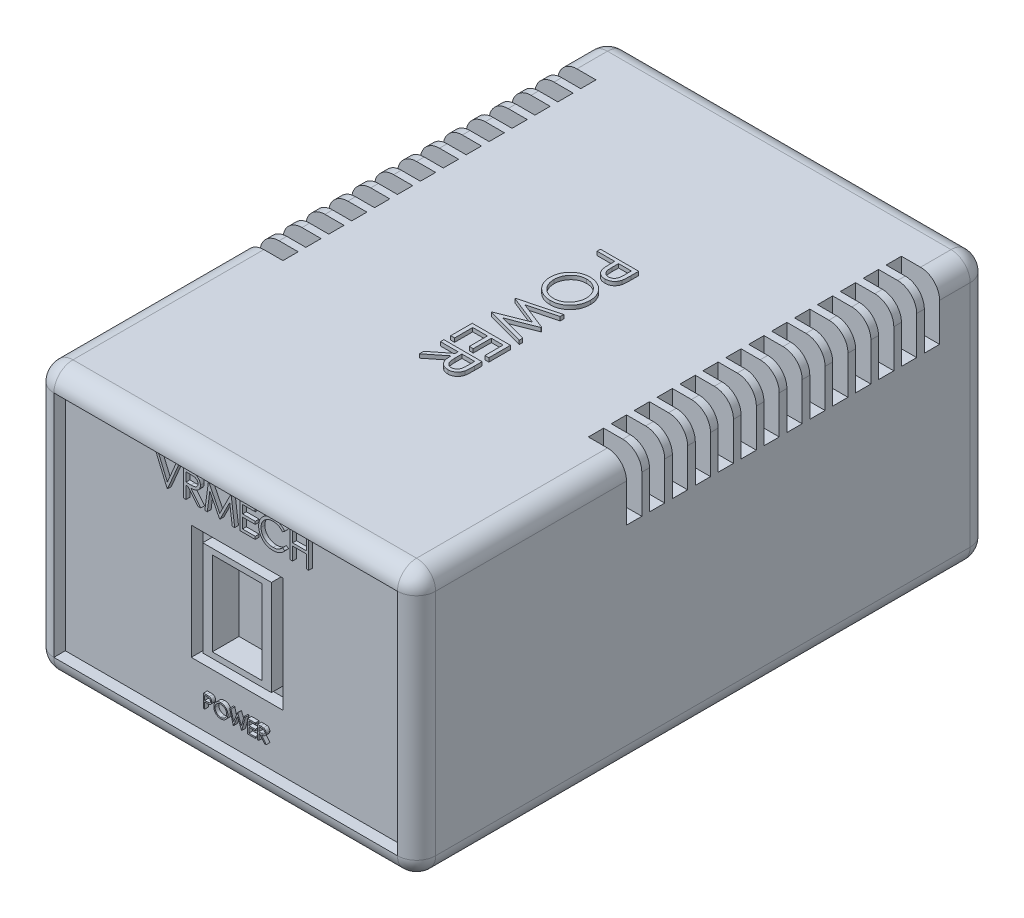
from build123d import *

# Parameters (mm, degrees)
IZIM1_W                     = 100
IZIM1_H                     = 70
Y_KSEKLIK_EKSTR_ZYON1_DEPTH = 150
RADYUS1_R                   = 5
IZIM2_W                     = 90
IZIM2_H                     = 60
KES_EKSTR_ZYON1_DEPTH       = 3
IZIM4_W                     = 10
IZIM4_H                     = 4
KES_EKSTR_ZYON2_DEPTH       = 15
IZIM5_W                     = 10
IZIM5_H                     = 4
KES_EKSTR_ZYON3_DEPTH       = 15
IZIM6_W                     = 24
IZIM6_H                     = 30
IZIM6_W_2                   = 18
IZIM6_H_2                   = 25
KES_EKSTR_ZYON4_DEPTH       = 3
IZIM7_W                     = 13
IZIM7_H                     = 22
KES_EKSTR_ZYON5_DEPTH       = 7
IZIM8_R                     = 0.5
KES_EKSTR_ZYON6_DEPTH       = 1
Y_KSEKLIK_EKSTR_ZYON2_DEPTH = 1
Y_KSEKLIK_EKSTR_ZYON3_DEPTH = 1
Y_KSEKLIK_EKSTR_ZYON4_DEPTH = 1


with BuildPart() as part:
    # Çizim1 → Yükseklik-Ekstrüzyon1 (new body)
    with BuildSketch(Plane.XY):
        Rectangle(IZIM1_W, IZIM1_H)
    extrude(amount=Y_KSEKLIK_EKSTR_ZYON1_DEPTH)

    # Radyus1
    radyus1_edges = [part.edges().sort_by_distance(p)[0] for p in [
        (-50, 0, 150),
        (0, -35, 150),
        (50, 0, 150),
        (0, -35, 0),
        (-50, 0, 0),
        (0, 35, 0),
        (50, 0, 0),
        (50, -35, 75),
        (-50, -35, 75),
        (-50, 35, 75),
        (50, 35, 75),
        (0, 35, 150),
    ]]
    fillet(radyus1_edges, radius=RADYUS1_R)

    # Çizim2 → Kes-Ekstrüzyon1 (cut)
    with BuildSketch(Plane.XY.offset(150)):
        Rectangle(IZIM2_W, IZIM2_H)
    extrude(amount=-KES_EKSTR_ZYON1_DEPTH, mode=Mode.SUBTRACT)

    # Çizim4 → Kes-Ekstrüzyon2 (cut)
    with BuildSketch(Plane(origin=(0, 35, 0), x_dir=(1, 0, 0), z_dir=(0, 1, 0))):
        with Locations((-45, -15)):
            Rectangle(IZIM4_W, IZIM4_H)
        with Locations((-45, -21)):
            Rectangle(IZIM4_W, IZIM4_H)
        with Locations((-45, -27)):
            Rectangle(IZIM4_W, IZIM4_H)
        with Locations((-45, -33)):
            Rectangle(IZIM4_W, IZIM4_H)
        with Locations((-45, -39)):
            Rectangle(IZIM4_W, IZIM4_H)
        with Locations((-45, -45)):
            Rectangle(IZIM4_W, IZIM4_H)
        with Locations((-45, -51)):
            Rectangle(IZIM4_W, IZIM4_H)
        with Locations((-45, -57)):
            Rectangle(IZIM4_W, IZIM4_H)
        with Locations((-45, -63)):
            Rectangle(IZIM4_W, IZIM4_H)
        with Locations((-45, -69)):
            Rectangle(IZIM4_W, IZIM4_H)
        with Locations((-45, -75)):
            Rectangle(IZIM4_W, IZIM4_H)
        with Locations((-45, -81)):
            Rectangle(IZIM4_W, IZIM4_H)
        with Locations((-45, -87)):
            Rectangle(IZIM4_W, IZIM4_H)
        with Locations((-45, -93)):
            Rectangle(IZIM4_W, IZIM4_H)
        with Locations((45, -93)):
            Rectangle(IZIM4_W, IZIM4_H)
        with Locations((45, -87)):
            Rectangle(IZIM4_W, IZIM4_H)
        with Locations((45, -81)):
            Rectangle(IZIM4_W, IZIM4_H)
        with Locations((45, -75)):
            Rectangle(IZIM4_W, IZIM4_H)
        with Locations((45, -69)):
            Rectangle(IZIM4_W, IZIM4_H)
        with Locations((45, -63)):
            Rectangle(IZIM4_W, IZIM4_H)
        with Locations((45, -57)):
            Rectangle(IZIM4_W, IZIM4_H)
        with Locations((45, -51)):
            Rectangle(IZIM4_W, IZIM4_H)
        with Locations((45, -39)):
            Rectangle(IZIM4_W, IZIM4_H)
        with Locations((45, -33)):
            Rectangle(IZIM4_W, IZIM4_H)
        with Locations((45, -27)):
            Rectangle(IZIM4_W, IZIM4_H)
        with Locations((45, -21)):
            Rectangle(IZIM4_W, IZIM4_H)
        with Locations((45, -15)):
            Rectangle(IZIM4_W, IZIM4_H)
    extrude(amount=-KES_EKSTR_ZYON2_DEPTH, mode=Mode.SUBTRACT)

    # Çizim5 → Kes-Ekstrüzyon3 (cut)
    with BuildSketch(Plane(origin=(0, 35, 0), x_dir=(1, 0, 0), z_dir=(0, 1, 0))):
        with Locations((45, -45)):
            Rectangle(IZIM5_W, IZIM5_H)
    extrude(amount=-KES_EKSTR_ZYON3_DEPTH, mode=Mode.SUBTRACT)

    # Çizim6 → Kes-Ekstrüzyon4 (cut)
    with BuildSketch(Plane.XY.offset(147)):
        Rectangle(IZIM6_W, IZIM6_H)
        Rectangle(IZIM6_W_2, IZIM6_H_2, mode=Mode.SUBTRACT)
    extrude(amount=-KES_EKSTR_ZYON4_DEPTH, mode=Mode.SUBTRACT)

    # Çizim7 → Kes-Ekstrüzyon5 (cut)
    with BuildSketch(Plane.XY.offset(147)):
        Rectangle(IZIM7_W, IZIM7_H)
    extrude(amount=-KES_EKSTR_ZYON5_DEPTH, mode=Mode.SUBTRACT)

    # Çizim8 → Kes-Ekstrüzyon6 (cut)
    with BuildSketch(Plane.ZY.offset(-6.5)):
        with Locations((145, 0)):
            Circle(IZIM8_R)
    extrude(amount=-KES_EKSTR_ZYON6_DEPTH, mode=Mode.SUBTRACT)

    # Çizim10 → Yükseklik-Ekstrüzyon2 (add)
    # profile 1 of 6: a face of its own
    with BuildSketch(Plane.XY.offset(147)):
        Polygon((14.897435897, 28.115628908), (15.525641026, 28.115628908), (15.525641026, 25.243834036), (19.115384615, 25.243834036), (19.115384615, 28.115628908), (19.743589744, 28.115628908), (19.743589744, 21.115628908), (19.115384615, 21.115628908), (19.115384615, 24.525885318), (15.525641026, 24.525885318), (15.525641026, 21.115628908), (14.897435897, 21.115628908), align=None)
    # profile 2 of 6: a face of its own
    with BuildSketch(Plane.XY.offset(147)):
        with BuildLine():
            Line((13.461538462, 26.83117378), (12.911858974, 26.410500703))
            add(Edge.make_bspline(
                [(12.911858974, 26.410500703), (12.872647198, 26.457232643), (12.794752304, 26.550066474), (12.669433899, 26.680425563), (12.538830613, 26.802556086), (12.402992371, 26.917039845), (12.259474132, 27.019873377), (12.111752534, 27.116415582), (11.957356444, 27.202951058), (11.743852975, 27.307877031), (11.464557278, 27.417369341), (11.1129676, 27.509175803), (10.745945403, 27.567618155), (10.495550204, 27.573947837), (10.368189103, 27.57716737)],
                knots=[0, 0, 0, 0, 0.757959112, 1.505699292, 2.245454638, 2.979532153, 3.711538275, 4.438200793, 5.171680507, 5.909471876, 7.393775596, 8.890124382, 10.418191784, 12, 12, 12, 12], degree=3))
            add(Edge.make_bspline(
                [(10.368189103, 27.57716737), (10.298022504, 27.576359445), (10.158340519, 27.574751093), (9.951043572, 27.553532842), (9.747617469, 27.523710422), (9.548194537, 27.479459776), (9.35302862, 27.423514538), (9.160843816, 27.35666371), (8.974422616, 27.27395403), (8.79118614, 27.18253751), (8.615627718, 27.079282621), (8.449517622, 26.966655917), (8.293461686, 26.845917724), (8.147336462, 26.716615511), (8.010992565, 26.57933159), (7.885417944, 26.432602907), (7.771047123, 26.27689856), (7.665613073, 26.114271745), (7.571187607, 25.945196162), (7.492127848, 25.769046021), (7.422117603, 25.588837815), (7.366719118, 25.402535493), (7.322870084, 25.211449962), (7.292614758, 25.015068386), (7.271637815, 24.813801026), (7.270037462, 24.677382401), (7.269230769, 24.60861769)],
                knots=[0, 0, 0, 0, 1.054917814, 2.100044995, 3.131103042, 4.146048494, 5.169673617, 6.183595914, 7.203665975, 8.234915748, 9.262203917, 10.264457458, 11.251630812, 12.227803204, 13.197192746, 14.159520551, 15.12972552, 16.100847026, 17.073214652, 18.039054194, 19.002613845, 19.979014051, 20.95965708, 21.949030935, 22.966165397, 24, 24, 24, 24], degree=3))
            add(Edge.make_bspline(
                [(7.269230769, 24.60861769), (7.271754407, 24.50515505), (7.276709236, 24.302019881), (7.320805904, 24.004478659), (7.387816087, 23.719437312), (7.48824724, 23.448677627), (7.612085342, 23.188860911), (7.768566565, 22.944383204), (7.949799639, 22.711550075), (8.158348478, 22.49586418), (8.38716011, 22.298836729), (8.632655933, 22.125335566), (8.894224509, 21.980705801), (9.168977769, 21.860353908), (9.459029997, 21.767840453), (9.763859602, 21.702712206), (10.082803593, 21.660227845), (10.300742392, 21.656160469), (10.411658654, 21.654090447)],
                knots=[0, 0, 0, 0, 1.029171465, 2.020641659, 2.987623507, 3.938342917, 4.889210282, 5.84687017, 6.821220943, 7.821438502, 8.827599549, 9.822697543, 10.807740252, 11.797342354, 12.80366471, 13.83203677, 14.896651826, 16, 16, 16, 16], degree=3))
            add(Edge.make_bspline(
                [(10.411658654, 21.654090447), (10.533864032, 21.657468006), (10.77439345, 21.664115851), (11.127129502, 21.720434349), (11.464801034, 21.811750185), (11.787426207, 21.93954603), (12.094095499, 22.105676605), (12.38528882, 22.30707236), (12.661251961, 22.545649026), (12.827194525, 22.727815282), (12.911858974, 22.820757113)],
                knots=[0, 0, 0, 0, 1.028121516, 2.023589091, 2.998037872, 3.967518031, 4.937445131, 5.927275754, 6.942489185, 8, 8, 8, 8], degree=3))
            Line((12.911858974, 22.820757113), (13.461538462, 22.404290767))
            add(Edge.make_bspline(
                [(13.461538462, 22.404290767), (13.417302242, 22.347213863), (13.329041691, 22.233333451), (13.186125657, 22.072790031), (13.035571062, 21.92178196), (12.876259642, 21.781526718), (12.710024059, 21.649217787), (12.533879435, 21.528614124), (12.35014137, 21.418032355), (12.159432412, 21.316778506), (11.961955186, 21.226944012), (11.757946316, 21.150036477), (11.548285165, 21.083786698), (11.332962148, 21.029282824), (11.111530635, 20.986740656), (10.884789687, 20.958301307), (10.652249936, 20.938817478), (10.495367094, 20.937041646), (10.415865385, 20.936141729)],
                knots=[0, 0, 0, 0, 0.986787822, 1.968848986, 2.935600012, 3.899624008, 4.868462664, 5.837806735, 6.815139263, 7.798259679, 8.787526145, 9.778297419, 10.776456485, 11.791383307, 12.812564526, 13.85620153, 14.913611965, 16, 16, 16, 16], degree=3))
            add(Edge.make_bspline(
                [(10.415865385, 20.936141729), (10.34057805, 20.936665714), (10.19170667, 20.937701829), (9.971909167, 20.954486164), (9.757930005, 20.977385638), (9.550380754, 21.0118659), (9.348128804, 21.05255458), (9.153007635, 21.107097093), (8.963097214, 21.168195427), (8.779160533, 21.2400054), (8.601041133, 21.321037765), (8.42931351, 21.412620883), (8.264056645, 21.513984612), (8.103645804, 21.622894633), (7.950450636, 21.742849237), (7.803143586, 21.872182506), (7.660898633, 22.010458527), (7.572893263, 22.110168234), (7.528645833, 22.160300382)],
                knots=[0, 0, 0, 0, 1.114604814, 2.203992996, 3.262667896, 4.300477797, 5.318619304, 6.316056647, 7.298880507, 8.271930387, 9.238335007, 10.195173496, 11.151986948, 12.108099108, 13.064862484, 14.031167946, 15.010108607, 16, 16, 16, 16], degree=3))
            add(Edge.make_bspline(
                [(7.528645833, 22.160300382), (7.457774546, 22.24738276), (7.316887593, 22.420496181), (7.136636226, 22.701068144), (6.982341115, 22.994004561), (6.857589274, 23.300844419), (6.760063807, 23.620899193), (6.692501417, 23.954330222), (6.648598208, 24.300826107), (6.643577631, 24.536499684), (6.641025641, 24.656293972)],
                knots=[0, 0, 0, 0, 0.994628077, 1.977248131, 2.950237994, 3.925870899, 4.908910175, 5.911660606, 6.938484602, 8, 8, 8, 8], degree=3))
            add(Edge.make_bspline(
                [(6.641025641, 24.656293972), (6.644136028, 24.782204879), (6.650255521, 25.029926728), (6.702247112, 25.393474635), (6.785884704, 25.741777433), (6.904678481, 26.074184922), (7.055289184, 26.392445482), (7.241342411, 26.694127892), (7.460676696, 26.981161491), (7.711571831, 27.249190994), (7.986706502, 27.494269699), (8.28134413, 27.709882107), (8.594908024, 27.889317139), (8.923943727, 28.039309463), (9.27091509, 28.15459839), (9.635081828, 28.235304763), (10.015759658, 28.285538996), (10.275484509, 28.291889412), (10.407451923, 28.295116088)],
                knots=[0, 0, 0, 0, 1.032925535, 2.032216505, 3.007276963, 3.968222605, 4.92396291, 5.891752235, 6.871517503, 7.883894988, 8.900124299, 9.891468569, 10.874487609, 11.85992873, 12.854644235, 13.869047385, 14.917252991, 16, 16, 16, 16], degree=3))
            add(Edge.make_bspline(
                [(10.407451923, 28.295116088), (10.487880867, 28.294151811), (10.647081862, 28.292243123), (10.882587166, 28.273630839), (11.11187182, 28.242603626), (11.335093784, 28.200371487), (11.553339017, 28.147956844), (11.764939499, 28.079676247), (11.971136872, 28.001603185), (12.170630689, 27.911686253), (12.362463789, 27.81075277), (12.546576426, 27.699921523), (12.721506143, 27.579329912), (12.88848384, 27.450003561), (13.044716262, 27.309206442), (13.194639219, 27.160811251), (13.333161376, 27.000543602), (13.418667766, 26.887733734), (13.461538462, 26.83117378)],
                knots=[0, 0, 0, 0, 1.096760587, 2.17092713, 3.219439832, 4.250915756, 5.268269357, 6.278326846, 7.281116186, 8.274029601, 9.260640565, 10.235837813, 11.203064059, 12.156899882, 13.114053108, 14.069676657, 15.032185724, 16, 16, 16, 16], degree=3))
        make_face()
    # profile 3 of 6: a face of its own
    with BuildSketch(Plane.XY.offset(147)):
        Polygon((1.794871795, 28.115628908), (5.743589744, 28.115628908), (5.743589744, 27.39768019), (2.423076923, 27.39768019), (2.423076923, 25.243834036), (5.743589744, 25.243834036), (5.743589744, 24.525885318), (2.423076923, 24.525885318), (2.423076923, 21.833577626), (5.743589744, 21.833577626), (5.743589744, 21.115628908), (1.794871795, 21.115628908), align=None)
    # profile 4 of 6: a face of its own
    with BuildSketch(Plane.XY.offset(147)):
        Polygon((-7.448717949, 21.115628908), (-6.524639423, 28.115628908), (-6.434895833, 28.115628908), (-3.544871795, 22.372039164), (-0.661858974, 28.115628908), (-0.570713141, 28.115628908), (0.358974359, 21.115628908), (-0.272035256, 21.115628908), (-0.942307692, 26.152487882), (-3.469150641, 21.115628908), (-3.610777244, 21.115628908), (-6.147435897, 26.163705831), (-6.81630609, 21.115628908), align=None)
    # profile 5 of 6: a face of its own
    with BuildSketch(Plane.XY.offset(147)):
        with BuildLine():
            Line((-13.012820513, 28.115628908), (-11.611979167, 28.115628908))
            add(Edge.make_bspline(
                [(-11.611979167, 28.115628908), (-11.51849691, 28.115317736), (-11.339000621, 28.114720251), (-11.08185408, 28.111388726), (-10.848199886, 28.101840014), (-10.638160207, 28.093622847), (-10.451738898, 28.078638965), (-10.288364316, 28.06431767), (-10.148788921, 28.045570349), (-10.064297218, 28.028159503), (-10.026041667, 28.020276344)],
                knots=[0, 0, 0, 0, 1.410062039, 2.707475311, 3.878576406, 4.937260626, 5.877586885, 6.699081471, 7.410979367, 8, 8, 8, 8], degree=3))
            add(Edge.make_bspline(
                [(-10.026041667, 28.020276344), (-9.974828418, 28.007622813), (-9.873494439, 27.982585686), (-9.727594307, 27.929666484), (-9.588565659, 27.868427235), (-9.456986011, 27.796499794), (-9.333514428, 27.713350235), (-9.216877807, 27.62041399), (-9.10654688, 27.518199579), (-9.00698362, 27.404129896), (-8.913105516, 27.284456876), (-8.833928263, 27.155049363), (-8.765675304, 27.019726308), (-8.71133427, 26.877111472), (-8.667578323, 26.728587928), (-8.636725844, 26.572810335), (-8.618223469, 26.410488385), (-8.616339758, 26.299772567), (-8.615384615, 26.243633716)],
                knots=[0, 0, 0, 0, 1.027469482, 2.033020251, 3.019912614, 3.986113645, 4.951240523, 5.91722682, 6.890402269, 7.87763091, 8.8651537, 9.85103654, 10.82876324, 11.815024772, 12.821070561, 13.842952187, 14.906261191, 16, 16, 16, 16], degree=3))
            add(Edge.make_bspline(
                [(-8.615384615, 26.243633716), (-8.618322612, 26.150363507), (-8.624055403, 25.968369171), (-8.677505611, 25.704247408), (-8.76505865, 25.457868779), (-8.885705228, 25.229543503), (-9.039344179, 25.023722212), (-9.223993762, 24.842941301), (-9.439756985, 24.691661476), (-9.640615617, 24.586755867), (-9.818044016, 24.51957005), (-9.964110641, 24.472297332), (-10.123444596, 24.435773401), (-10.294519266, 24.403053138), (-10.478046577, 24.378349749), (-10.673586655, 24.36025656), (-10.881278959, 24.348948463), (-11.023957097, 24.347264453), (-11.097355769, 24.346398139)],
                knots=[0, 0, 0, 0, 1.260483769, 2.459530307, 3.627416485, 4.787058657, 5.939039949, 7.08810263, 8.267026773, 9.491475466, 10.141966685, 10.831826277, 11.566392101, 12.351337768, 13.187381173, 14.07005841, 15.007169909, 16, 16, 16, 16], degree=3))
            Line((-11.097355769, 24.346398139), (-8.525641026, 21.115628908))
            Line((-8.525641026, 21.115628908), (-9.302483974, 21.115628908))
            Line((-9.302483974, 21.115628908), (-11.874198718, 24.346398139))
            Line((-11.874198718, 24.346398139), (-12.384615385, 24.346398139))
            Line((-12.384615385, 24.346398139), (-12.384615385, 21.115628908))
            Line((-12.384615385, 21.115628908), (-13.012820513, 21.115628908))
            Line((-13.012820513, 21.115628908), (-13.012820513, 28.115628908))
        make_face()
        with BuildLine():
            Line((-12.384615385, 27.39768019), (-12.384615385, 25.064346857))
            Line((-12.384615385, 25.064346857), (-11.102964744, 25.054531152))
            add(Edge.make_bspline(
                [(-11.102964744, 25.054531152), (-11.043124666, 25.054504678), (-10.927137552, 25.054453366), (-10.759336222, 25.062440918), (-10.603095999, 25.071527554), (-10.459014494, 25.085426246), (-10.327027344, 25.103338389), (-10.207200517, 25.125744357), (-10.099338413, 25.151848483), (-9.973541336, 25.192251734), (-9.833068274, 25.256263771), (-9.680405354, 25.349394768), (-9.550400678, 25.466533007), (-9.440564954, 25.600479919), (-9.352306091, 25.747752416), (-9.290081982, 25.906585155), (-9.250597098, 26.072968351), (-9.245940007, 26.187324567), (-9.243589744, 26.245035959)],
                knots=[0, 0, 0, 0, 1.146690395, 2.22261258, 3.21895312, 4.145990853, 4.996080663, 5.770904154, 6.481378293, 7.121626537, 8.300444488, 9.431385265, 10.535395872, 11.636531494, 12.74115979, 13.810798291, 14.895190096, 16, 16, 16, 16], degree=3))
            add(Edge.make_bspline(
                [(-9.243589744, 26.245035959), (-9.245993986, 26.301329107), (-9.250758316, 26.412881584), (-9.289655854, 26.576193405), (-9.355434616, 26.730327305), (-9.444079092, 26.874656275), (-9.552077402, 27.005667747), (-9.678713027, 27.117762053), (-9.820523418, 27.210260982), (-9.953065814, 27.269369743), (-10.071534239, 27.30560945), (-10.174393559, 27.331111777), (-10.290616515, 27.351600715), (-10.420767432, 27.368016837), (-10.564290694, 27.382126725), (-10.721911996, 27.391630283), (-10.892585556, 27.397258011), (-11.010879419, 27.397536189), (-11.072115385, 27.39768019)],
                knots=[0, 0, 0, 0, 1.101028733, 2.181837193, 3.264309656, 4.369019818, 5.486613113, 6.575447106, 7.666700264, 8.788928104, 9.402425223, 10.0903467, 10.862060571, 11.710948788, 12.657782767, 13.684531032, 14.801375019, 16, 16, 16, 16], degree=3))
            Line((-11.072115385, 27.39768019), (-12.384615385, 27.39768019))
        make_face(mode=Mode.SUBTRACT)
    # profile 6 of 6: a face of its own
    with BuildSketch(Plane.XY.offset(147)):
        Polygon((-20.282051282, 28.115628908), (-19.608974359, 28.115628908), (-17.275641026, 22.599202626), (-14.942307692, 28.115628908), (-14.269230769, 28.115628908), (-17.230769231, 21.115628908), (-17.320512821, 21.115628908), align=None)
    extrude(amount=Y_KSEKLIK_EKSTR_ZYON2_DEPTH)

    # Çizim11 → Yükseklik-Ekstrüzyon3 (add)
    # profile 1 of 5: a face of its own
    with BuildSketch(Plane(origin=(0, 35, 0), x_dir=(1, 0, 0), z_dir=(0, 1, 0))):
        with BuildLine():
            Line((10, -51.821992877), (10, -53.783130698))
            add(Edge.make_bspline(
                [(10, -53.783130698), (9.999851725, -53.918019001), (9.999567624, -54.17647098), (9.990954064, -54.547085425), (9.97944923, -54.883684659), (9.963500963, -55.18554289), (9.944653563, -55.453588884), (9.918219164, -55.68660974), (9.89061832, -55.886437044), (9.862557158, -56.006169757), (9.849759615, -56.060774929)],
                knots=[0, 0, 0, 0, 1.415646017, 2.712440637, 3.8905458, 4.950247383, 5.884950622, 6.709939814, 7.411656543, 8, 8, 8, 8], degree=3))
            add(Edge.make_bspline(
                [(9.849759615, -56.060774929), (9.830839928, -56.129899474), (9.793446371, -56.266519731), (9.718547576, -56.463377494), (9.629750455, -56.650682959), (9.528505683, -56.82902644), (9.410670835, -56.996409319), (9.279973365, -57.154974207), (9.136485178, -57.305630587), (8.97742465, -57.443260708), (8.808656295, -57.569966904), (8.626421551, -57.6786616), (8.434686687, -57.770602962), (8.231488104, -57.845691053), (8.018060789, -57.902786966), (7.79378168, -57.94497123), (7.559421421, -57.971961245), (7.399246958, -57.974530913), (7.317708333, -57.975839031)],
                knots=[0, 0, 0, 0, 0.999487232, 1.975422798, 2.933948774, 3.889618007, 4.832992075, 5.786114792, 6.754729845, 7.731954186, 8.717668599, 9.695514499, 10.68728626, 11.680675814, 12.71351902, 13.766008651, 14.862761406, 16, 16, 16, 16], degree=3))
            add(Edge.make_bspline(
                [(7.317708333, -57.975839031), (7.235486114, -57.97463496), (7.074612788, -57.972279115), (6.839261965, -57.944004014), (6.614352279, -57.905917752), (6.40038242, -57.847354746), (6.198623076, -57.770652822), (6.005990985, -57.680675529), (5.825763351, -57.572151156), (5.657285872, -57.447451643), (5.500400408, -57.308732801), (5.356243853, -57.15658155), (5.225660029, -56.991612142), (5.108356189, -56.814348862), (5.007052534, -56.62306358), (4.916317377, -56.420657427), (4.840114346, -56.205371094), (4.800028457, -56.056392483), (4.779647436, -55.980646723)],
                knots=[0, 0, 0, 0, 1.121902311, 2.195077645, 3.232258892, 4.234102512, 5.217864754, 6.176164875, 7.132989551, 8.084763148, 9.034132444, 9.988522005, 10.94243251, 11.903244335, 12.886203696, 13.894208494, 14.929344452, 16, 16, 16, 16], degree=3))
            add(Edge.make_bspline(
                [(4.779647436, -55.980646723), (4.766324633, -55.917997198), (4.737126935, -55.78069712), (4.704531344, -55.554575056), (4.676709628, -55.291302525), (4.655849235, -54.991238868), (4.637991039, -54.654653425), (4.623796485, -54.281364119), (4.615996903, -53.870638184), (4.615594638, -53.584148915), (4.615384615, -53.434573005)],
                knots=[0, 0, 0, 0, 0.601384939, 1.31797006, 2.144135048, 3.087295005, 4.142315834, 5.309527816, 6.595305764, 8, 8, 8, 8], degree=3))
            Line((4.615384615, -53.434573005), (4.615384615, -52.719428775))
            Line((4.615384615, -52.719428775), (0, -52.719428775))
            Line((0, -52.719428775), (0, -51.821992877))
            Line((0, -51.821992877), (10, -51.821992877))
        make_face()
        with BuildLine():
            Line((8.974358974, -52.719428775), (5.641025641, -52.719428775))
            Line((5.641025641, -52.719428775), (5.618990385, -54.470230057))
            add(Edge.make_bspline(
                [(5.618990385, -54.470230057), (5.618936926, -54.555716395), (5.618833725, -54.720746009), (5.630376311, -54.959789808), (5.643108557, -55.180998374), (5.663047802, -55.384852093), (5.68931963, -55.569793105), (5.717916012, -55.738196911), (5.75665842, -55.88759817), (5.810678547, -56.062669089), (5.901015276, -56.257089364), (6.035520069, -56.467193738), (6.202263109, -56.648136429), (6.392316205, -56.803670257), (6.604511207, -56.924208561), (6.829766104, -57.014868734), (7.068222635, -57.067677764), (7.231319196, -57.074803705), (7.313701923, -57.078403134)],
                knots=[0, 0, 0, 0, 1.160368111, 2.240066715, 3.248291599, 4.168343349, 5.019594299, 5.784185847, 6.485545725, 7.113397927, 8.269509094, 9.383373363, 10.487084095, 11.595623793, 12.704274681, 13.786671823, 14.88201193, 16, 16, 16, 16], degree=3))
            add(Edge.make_bspline(
                [(7.313701923, -57.078403134), (7.394091428, -57.074784484), (7.553895815, -57.067591057), (7.78821302, -57.014452181), (8.011078048, -56.924385539), (8.220660664, -56.802853471), (8.409935966, -56.651785515), (8.572915872, -56.474852684), (8.705715876, -56.275667827), (8.790839273, -56.090287295), (8.84289968, -55.925727092), (8.879309446, -55.782775093), (8.908383893, -55.621374287), (8.931924933, -55.441465999), (8.952077802, -55.244446581), (8.965751985, -55.028622792), (8.973756157, -54.794812392), (8.97415317, -54.632496474), (8.974358974, -54.548355057)],
                knots=[0, 0, 0, 0, 1.120550889, 2.227516482, 3.330715807, 4.461473166, 5.594337325, 6.694900473, 7.802844763, 8.919519911, 9.52614448, 10.208195984, 10.975273469, 11.811520316, 12.738076669, 13.736566072, 14.826679847, 16, 16, 16, 16], degree=3))
            Line((8.974358974, -54.548355057), (8.974358974, -52.719428775))
        make_face(mode=Mode.SUBTRACT)
    # profile 2 of 5: a face of its own
    with BuildSketch(Plane(origin=(0, 35, 0), x_dir=(1, 0, 0), z_dir=(0, 1, 0))):
        with BuildLine():
            add(Edge.make_bspline(
                [(10.256410256, -64.706608262), (10.251720273, -64.891774241), (10.242508758, -65.255455502), (10.17199764, -65.78995574), (10.050008587, -66.300225501), (9.887551039, -66.790432972), (9.670794245, -67.254672488), (9.408949056, -67.696595849), (9.098291416, -68.114953569), (8.744034019, -68.505910895), (8.357182497, -68.862360551), (7.943152065, -69.173788161), (7.507612223, -69.437097852), (7.049047409, -69.652914343), (6.569475928, -69.822377522), (6.066171026, -69.939278555), (5.542439743, -70.013961858), (5.185219838, -70.022692255), (5.00400641, -70.027121082)],
                knots=[0, 0, 0, 0, 1.06508495, 2.091914715, 3.094501328, 4.079693967, 5.057647778, 6.035986298, 7.030177474, 8.050107388, 9.066943579, 10.051896531, 11.025616101, 11.9896488, 12.96281505, 13.945825876, 14.957941789, 16, 16, 16, 16], degree=3))
            add(Edge.make_bspline(
                [(5.00400641, -70.027121082), (4.824127837, -70.022692912), (4.46956633, -70.013964475), (3.949158714, -69.939193555), (3.448891415, -69.821944512), (2.969648141, -69.654486327), (2.510743141, -69.43970662), (2.074402732, -69.174617339), (1.657505512, -68.865251581), (1.268776002, -68.510033962), (0.911626105, -68.123274693), (0.599714309, -67.708076726), (0.333162649, -67.27296552), (0.118826425, -66.814677917), (-0.051836088, -66.338323063), (-0.168303261, -65.839535185), (-0.243400628, -65.320539919), (-0.252026128, -64.96662347), (-0.256410256, -64.786736467)],
                knots=[0, 0, 0, 0, 1.04355943, 2.056976533, 3.044937463, 4.02179873, 4.997890911, 5.980248884, 6.980147982, 8.006253959, 9.032111064, 10.031228745, 11.015595249, 11.988180414, 12.962670953, 13.946861971, 14.95644057, 16, 16, 16, 16], degree=3))
            add(Edge.make_bspline(
                [(-0.256410256, -64.786736467), (-0.251984031, -64.605523773), (-0.243258762, -64.248305314), (-0.16844623, -63.723918866), (-0.051502314, -63.220249537), (0.115781777, -62.73884812), (0.331162929, -62.279556638), (0.59583438, -61.842419512), (0.907713335, -61.426911451), (1.262458028, -61.037260734), (1.649403169, -60.681172652), (2.061872021, -60.367972622), (2.495941769, -60.104827058), (2.949823096, -59.889354983), (3.422342797, -59.718924777), (3.916473197, -59.602614526), (4.429445413, -59.52737187), (4.778710535, -59.518700479), (4.955929487, -59.51430057)],
                knots=[0, 0, 0, 0, 1.053167129, 2.076072758, 3.073341244, 4.055601477, 5.033424535, 6.017524495, 7.021518915, 8.049444456, 9.077120685, 10.074910483, 11.055688766, 12.022980584, 12.991883888, 13.970269434, 14.970104079, 16, 16, 16, 16], degree=3))
            add(Edge.make_bspline(
                [(4.955929487, -59.51430057), (5.074880514, -59.515826699), (5.311281947, -59.518859705), (5.662321377, -59.555428007), (6.007753236, -59.608384198), (6.346416349, -59.684675713), (6.678366018, -59.783085295), (7.002923388, -59.904358411), (7.322761859, -60.043337448), (7.631794336, -60.208811189), (7.930505869, -60.389347993), (8.215161318, -60.586205238), (8.480675968, -60.800755505), (8.731316214, -61.029933994), (8.962804196, -61.276913048), (9.180186887, -61.537975642), (9.38121402, -61.814487771), (9.561663472, -62.106886748), (9.727408486, -62.407717749), (9.865791933, -62.719163318), (9.988104342, -63.034652267), (10.085306436, -63.356963545), (10.162660442, -63.685351595), (10.215220535, -64.020226936), (10.25187009, -64.361244652), (10.254890356, -64.590991751), (10.256410256, -64.706608262)],
                knots=[0, 0, 0, 0, 1.037115869, 2.061148057, 3.07517727, 4.084041727, 5.086514338, 6.092668487, 7.104487461, 8.125783165, 9.147610153, 10.147694368, 11.141876323, 12.122903372, 13.107606018, 14.091946891, 15.084523921, 16.086505767, 17.087268121, 18.077809654, 19.05670789, 20.036870126, 21.011670792, 21.99694167, 22.991993299, 24, 24, 24, 24], degree=3))
        make_face()
        with BuildLine():
            add(Edge.make_bspline(
                [(9.230769231, -64.750678775), (9.229612952, -64.655779605), (9.227311449, -64.466888508), (9.196972691, -64.18607875), (9.153775095, -63.908946881), (9.091999222, -63.635507979), (9.008604034, -63.367233525), (8.910340594, -63.101444435), (8.794748549, -62.839416935), (8.659965346, -62.584080305), (8.512729335, -62.335861342), (8.351132709, -62.100032674), (8.175959042, -61.878946852), (7.989522262, -61.67189566), (7.789925445, -61.479482441), (7.580354173, -61.297806848), (7.354775423, -61.134180824), (7.119317636, -60.984221668), (6.874284408, -60.850027936), (6.622256267, -60.730698325), (6.361177152, -60.633086879), (6.093879562, -60.553480087), (5.820786819, -60.487480628), (5.539827251, -60.445669416), (5.252412645, -60.415005532), (5.058178777, -60.412834545), (4.959935897, -60.411736467)],
                knots=[0, 0, 0, 0, 1.008585988, 2.007529826, 2.999688727, 3.990042337, 4.984966365, 5.984641633, 7.001812546, 8.027570247, 9.052811818, 10.068991095, 11.064725446, 12.050001529, 13.029093193, 14.010961114, 14.996492974, 15.989185205, 16.977398719, 17.96520407, 18.951579521, 19.937648295, 20.929603947, 21.935788061, 22.955928099, 24, 24, 24, 24], degree=3))
            add(Edge.make_bspline(
                [(4.959935897, -60.411736467), (4.815472409, -60.41537893), (4.531268037, -60.422544781), (4.114787626, -60.485280695), (3.714535379, -60.581914908), (3.332701353, -60.724364526), (2.966003402, -60.90250914), (2.617694531, -61.122585969), (2.287680605, -61.383326214), (1.97826555, -61.679507718), (1.695848967, -62.00328688), (1.447953514, -62.34709468), (1.238209943, -62.707247844), (1.067338307, -63.084685566), (0.931939056, -63.47739282), (0.839142968, -63.887900109), (0.778070238, -64.313472851), (0.772205221, -64.603560437), (0.769230769, -64.750678775)],
                knots=[0, 0, 0, 0, 1.032063989, 2.030389145, 3.003944642, 3.970395727, 4.937377036, 5.913328081, 6.909231446, 7.93887556, 8.970685674, 9.976071282, 10.964166581, 11.944589148, 12.933237628, 13.927779006, 14.949070134, 16, 16, 16, 16], degree=3))
            add(Edge.make_bspline(
                [(0.769230769, -64.750678775), (0.770589349, -64.849563068), (0.773283821, -65.04568032), (0.800422957, -65.337381771), (0.843942363, -65.623828246), (0.906602193, -65.904617044), (0.985019773, -66.17943291), (1.078195918, -66.44941017), (1.19438572, -66.711720718), (1.322967657, -66.969493865), (1.468497551, -67.216278936), (1.627835379, -67.450418003), (1.799876257, -67.670553664), (1.984694048, -67.877162722), (2.180695571, -68.07090915), (2.39292035, -68.24653192), (2.615170446, -68.412118157), (2.851177439, -68.56147686), (3.096727022, -68.695403791), (3.349709813, -68.811861562), (3.609256397, -68.910721961), (3.875806673, -68.990513822), (4.148836878, -69.053044757), (4.428717316, -69.096129959), (4.714886808, -69.126268432), (4.908440691, -69.12854007), (5.006009615, -69.129685185)],
                knots=[0, 0, 0, 0, 1.047226202, 2.076964084, 3.100341814, 4.114585567, 5.122123135, 6.126552355, 7.137064942, 8.158803602, 9.176592812, 10.169297945, 11.156925011, 12.133779169, 13.104132798, 14.073170763, 15.049307625, 16.038276215, 17.028988595, 18.010110019, 18.986169996, 19.968539974, 20.955178716, 21.950601663, 22.966915103, 24, 24, 24, 24], degree=3))
            add(Edge.make_bspline(
                [(5.006009615, -69.129685185), (5.102911056, -69.128539148), (5.295132914, -69.126265772), (5.579306681, -69.096144416), (5.857172999, -69.052999015), (6.127641008, -68.990819849), (6.390779651, -68.910676553), (6.646341787, -68.811855609), (6.895279487, -68.695326182), (7.136977478, -68.561588398), (7.368905302, -68.411257474), (7.590626479, -68.246988207), (7.797977175, -68.065944357), (7.996076274, -67.873298564), (8.180698919, -67.664238921), (8.351905726, -67.439712253), (8.513830873, -67.202445034), (8.659898137, -66.95122271), (8.794817546, -66.691960453), (8.910312287, -66.425897805), (9.009029008, -66.155582736), (9.091657869, -65.882399246), (9.153835618, -65.604422867), (9.196957192, -65.323272373), (9.227314698, -65.038467205), (9.229614066, -64.846912668), (9.230769231, -64.750678775)],
                knots=[0, 0, 0, 0, 1.029967493, 2.04313025, 3.035375922, 4.01889446, 4.991458755, 5.958017022, 6.930036849, 7.912118993, 8.892942568, 9.867138445, 10.843712051, 11.817804417, 12.803729339, 13.806387533, 14.818654169, 15.856205545, 16.894655496, 17.924916651, 18.938004761, 19.953404357, 20.957695443, 21.963967554, 22.97713031, 24, 24, 24, 24], degree=3))
        make_face(mode=Mode.SUBTRACT)
    # profile 3 of 5: a face of its own
    with BuildSketch(Plane(origin=(0, 35, 0), x_dir=(1, 0, 0), z_dir=(0, 1, 0))):
        Polygon((10, -71.437377493), (10, -72.364861467), (2.666266026, -74.321992877), (10, -77.232649929), (10, -77.362858262), (2.716346154, -80.219428775), (10, -82.186576211), (10, -83.104044159), (0, -80.407730057), (0, -80.279524929), (7.648237179, -77.270710826), (0, -74.225839031), (0, -74.097633903), align=None)
    # profile 4 of 5: a face of its own
    with BuildSketch(Plane(origin=(0, 35, 0), x_dir=(1, 0, 0), z_dir=(0, 1, 0))):
        Polygon((10, -85.411736467), (10, -91.052762108), (8.974358974, -91.052762108), (8.974358974, -86.309172364), (5.897435897, -86.309172364), (5.897435897, -91.052762108), (4.871794872, -91.052762108), (4.871794872, -86.309172364), (1.025641026, -86.309172364), (1.025641026, -91.052762108), (0, -91.052762108), (0, -85.411736467), align=None)
    # profile 5 of 5: a face of its own
    with BuildSketch(Plane(origin=(0, 35, 0), x_dir=(1, 0, 0), z_dir=(0, 1, 0))):
        with BuildLine():
            Line((10, -92.847633903), (10, -94.848835826))
            add(Edge.make_bspline(
                [(10, -94.848835826), (9.999555469, -94.982381907), (9.998701919, -95.238805177), (9.993942596, -95.606157378), (9.98030158, -95.939949084), (9.96856277, -96.240005768), (9.947157224, -96.506321925), (9.926698232, -96.739714184), (9.899916344, -96.939107605), (9.875043707, -97.059810038), (9.863782051, -97.114460826)],
                knots=[0, 0, 0, 0, 1.410062039, 2.707475311, 3.878576406, 4.937260626, 5.877586885, 6.699081471, 7.410979367, 8, 8, 8, 8], degree=3))
            add(Edge.make_bspline(
                [(9.863782051, -97.114460826), (9.845707629, -97.187623898), (9.809944362, -97.332389275), (9.734315752, -97.540799339), (9.64694087, -97.739480669), (9.543519276, -97.927687671), (9.425854864, -98.105437805), (9.293260166, -98.27246493), (9.145059926, -98.427814106), (8.985038555, -98.572680668), (8.811799819, -98.703997544), (8.627867335, -98.817635118), (8.434391495, -98.914942403), (8.230698544, -98.992625735), (8.01851037, -99.055119593), (7.795974172, -99.099198599), (7.564084781, -99.125629448), (7.405919451, -99.128320618), (7.325721154, -99.129685185)],
                knots=[0, 0, 0, 0, 1.02737288, 2.032829108, 3.019628684, 3.985738875, 4.958353778, 5.924249254, 6.890702889, 7.883913451, 8.865824512, 9.85161466, 10.829249435, 11.81541824, 12.821369441, 13.843154991, 14.906364023, 16, 16, 16, 16], degree=3))
            add(Edge.make_bspline(
                [(7.325721154, -99.129685185), (7.192477844, -99.125488156), (6.932485637, -99.117298667), (6.555170975, -99.040939706), (6.203193673, -98.915869499), (5.877043561, -98.743496747), (5.58290636, -98.524088393), (5.325429869, -98.260409444), (5.107979241, -97.95380649), (4.958788945, -97.667039191), (4.862793514, -97.413603808), (4.794911707, -97.204347609), (4.743348917, -96.97591114), (4.696485544, -96.731571671), (4.660725027, -96.469441898), (4.635328262, -96.190049687), (4.61899795, -95.892696261), (4.616612021, -95.688868371), (4.615384615, -95.584012108)],
                knots=[0, 0, 0, 0, 1.260402266, 2.459371274, 3.627181936, 4.786749125, 5.93865593, 7.087644312, 8.261344208, 9.485713728, 10.136162886, 10.825977872, 11.566646758, 12.35154167, 13.181268117, 14.0701832, 15.007234106, 16, 16, 16, 16], degree=3))
            Line((4.615384615, -95.584012108), (0, -99.257890313))
            Line((0, -99.257890313), (0, -98.148114672))
            Line((0, -98.148114672), (4.615384615, -94.474236467))
            Line((4.615384615, -94.474236467), (4.615384615, -93.7450698))
            Line((4.615384615, -93.7450698), (0, -93.7450698))
            Line((0, -93.7450698), (0, -92.847633903))
            Line((0, -92.847633903), (10, -92.847633903))
        make_face()
        with BuildLine():
            Line((8.974358974, -93.7450698), (5.641025641, -93.7450698))
            Line((5.641025641, -93.7450698), (5.627003205, -95.575999287))
            add(Edge.make_bspline(
                [(5.627003205, -95.575999287), (5.626965386, -95.661485113), (5.626892083, -95.827180989), (5.638302868, -96.066897179), (5.65128379, -96.290097482), (5.671139021, -96.495928257), (5.696727936, -96.68448115), (5.728736012, -96.855662916), (5.766029086, -97.009749728), (5.823741838, -97.189467875), (5.915229378, -97.390089348), (6.048109817, -97.608392329), (6.216325888, -97.793664252), (6.405621218, -97.95340456), (6.618028038, -98.076445282), (6.844118409, -98.16599734), (7.081940419, -98.222196247), (7.245288544, -98.228877502), (7.327724359, -98.232249287)],
                knots=[0, 0, 0, 0, 1.14660753, 2.222451964, 3.218720504, 4.145691244, 4.995719623, 5.770487122, 6.480909919, 7.121111896, 8.299844659, 9.430703709, 10.534634535, 11.641396424, 12.741395289, 13.810956493, 14.895269934, 16, 16, 16, 16], degree=3))
            add(Edge.make_bspline(
                [(7.327724359, -98.232249287), (7.408165442, -98.228867138), (7.567570317, -98.222164952), (7.800294421, -98.165888452), (8.021514026, -98.075010134), (8.227012537, -97.9475777), (8.415103942, -97.793595148), (8.573815134, -97.610717972), (8.706726507, -97.408156089), (8.791041203, -97.218698311), (8.842837059, -97.049475008), (8.879240385, -96.902526132), (8.908734238, -96.73585536), (8.931665151, -96.549862127), (8.952300353, -96.344882924), (8.965679672, -96.12035648), (8.973766134, -95.876542072), (8.974156762, -95.707550123), (8.974358974, -95.6200698)],
                knots=[0, 0, 0, 0, 1.100801541, 2.181386982, 3.260112282, 4.364594493, 5.481957178, 6.577424609, 7.668452592, 8.790448866, 9.403819393, 10.091598921, 10.863153553, 11.720938239, 12.658472417, 13.685008818, 14.801622349, 16, 16, 16, 16], degree=3))
            Line((8.974358974, -95.6200698), (8.974358974, -93.7450698))
        make_face(mode=Mode.SUBTRACT)
    extrude(amount=Y_KSEKLIK_EKSTR_ZYON3_DEPTH)

    # Çizim12 → Yükseklik-Ekstrüzyon4 (add)
    # profile 1 of 5: a face of its own
    with BuildSketch(Plane.XY.offset(147)):
        with BuildLine():
            Line((-7.800671555, -20.498229655), (-7.114273318, -20.498229655))
            add(Edge.make_bspline(
                [(-7.114273318, -20.498229655), (-7.067062412, -20.498281552), (-6.976604219, -20.498380987), (-6.846889163, -20.501395733), (-6.729079432, -20.505422425), (-6.623429051, -20.511004318), (-6.529612953, -20.517600909), (-6.448055653, -20.526852948), (-6.378116097, -20.536513243), (-6.336209647, -20.54633465), (-6.317097837, -20.55081379)],
                knots=[0, 0, 0, 0, 1.415646017, 2.712440637, 3.8905458, 4.950247383, 5.884950622, 6.709939814, 7.411656543, 8, 8, 8, 8], degree=3))
            add(Edge.make_bspline(
                [(-6.317097837, -20.55081379), (-6.292904303, -20.55743574), (-6.245087326, -20.570523602), (-6.176186283, -20.596737325), (-6.110632438, -20.62781949), (-6.048200879, -20.66324343), (-5.989658796, -20.704528994), (-5.934132755, -20.750002612), (-5.882112775, -20.800714181), (-5.833891383, -20.85609492), (-5.789606585, -20.91521513), (-5.751476903, -20.97895736), (-5.719549676, -21.046248664), (-5.692166404, -21.117042235), (-5.67245795, -21.191932558), (-5.65761105, -21.270399271), (-5.648187422, -21.352433961), (-5.647284861, -21.408493828), (-5.646825401, -21.437031739)],
                knots=[0, 0, 0, 0, 0.999701418, 1.975846123, 2.934577507, 3.890451536, 4.834027766, 5.787354733, 6.749476667, 7.726910423, 8.712836071, 9.690891519, 10.682875813, 11.679750201, 12.712814741, 13.765529915, 14.8625177, 16, 16, 16, 16], degree=3))
            add(Edge.make_bspline(
                [(-5.646825401, -21.437031739), (-5.647246826, -21.465809516), (-5.648071372, -21.52211518), (-5.657967657, -21.604487968), (-5.671297849, -21.683206358), (-5.691794901, -21.758095808), (-5.718640574, -21.828711579), (-5.750132627, -21.896132811), (-5.788116158, -21.959212483), (-5.831760987, -22.0181796), (-5.880312582, -22.073089513), (-5.93356552, -22.123544307), (-5.991304812, -22.169248645), (-6.05334696, -22.210304989), (-6.120296809, -22.245761269), (-6.191138963, -22.277518574), (-6.266489179, -22.304189634), (-6.318631693, -22.318219696), (-6.345142709, -22.325353053)],
                knots=[0, 0, 0, 0, 1.121902311, 2.195077645, 3.232258892, 4.234102512, 5.217864754, 6.176164875, 7.132989551, 8.084763148, 9.034132444, 9.988522005, 10.94243251, 11.903244335, 12.886203696, 13.894208494, 14.929344452, 16, 16, 16, 16], degree=3))
            add(Edge.make_bspline(
                [(-6.345142709, -22.325353053), (-6.367070043, -22.330016034), (-6.41512507, -22.340235228), (-6.494267793, -22.351643685), (-6.586413178, -22.361381286), (-6.691435458, -22.368682423), (-6.809240363, -22.374932792), (-6.939891621, -22.379900886), (-7.083645698, -22.382630739), (-7.183916942, -22.382771532), (-7.23626851, -22.38284504)],
                knots=[0, 0, 0, 0, 0.601384939, 1.31797006, 2.144135048, 3.087295005, 4.142315834, 5.309527816, 6.595305764, 8, 8, 8, 8], degree=3))
            Line((-7.23626851, -22.38284504), (-7.486568991, -22.38284504))
            Line((-7.486568991, -22.38284504), (-7.486568991, -23.998229655))
            Line((-7.486568991, -23.998229655), (-7.800671555, -23.998229655))
            Line((-7.800671555, -23.998229655), (-7.800671555, -20.498229655))
        make_face()
        with BuildLine():
            Line((-7.486568991, -20.857204014), (-7.486568991, -22.023870681))
            Line((-7.486568991, -22.023870681), (-6.873788542, -22.031583021))
            add(Edge.make_bspline(
                [(-6.873788542, -22.031583021), (-6.843868617, -22.031598484), (-6.786108817, -22.031628337), (-6.702672593, -22.027643113), (-6.625263306, -22.02304258), (-6.554118731, -22.016306657), (-6.489206796, -22.006785399), (-6.430419267, -21.997173662), (-6.378211984, -21.983268299), (-6.317112783, -21.96454523), (-6.249029435, -21.932612614), (-6.174961887, -21.886262724), (-6.1121913, -21.827182016), (-6.057873004, -21.760754185), (-6.014767126, -21.686855055), (-5.983211133, -21.607786118), (-5.964669976, -21.524358269), (-5.962183782, -21.46727013), (-5.960927965, -21.438433982)],
                knots=[0, 0, 0, 0, 1.160613943, 2.240541288, 3.23993089, 4.169200891, 5.011653406, 5.7853311, 6.478053781, 7.106038997, 8.262395093, 9.384106736, 10.481365981, 11.59014053, 12.70357646, 13.786202915, 14.881775077, 16, 16, 16, 16], degree=3))
            add(Edge.make_bspline(
                [(-5.960927965, -21.438433982), (-5.962190612, -21.410295469), (-5.964700597, -21.354359587), (-5.98335646, -21.272380826), (-6.014705774, -21.194145122), (-6.058162368, -21.121172036), (-6.110903498, -21.054983232), (-6.172202841, -20.997486105), (-6.241916103, -20.951264403), (-6.306764334, -20.921431121), (-6.36436552, -20.903215846), (-6.41439748, -20.890471005), (-6.470888154, -20.880295399), (-6.533855934, -20.872055896), (-6.602812768, -20.865002435), (-6.678351083, -20.860216458), (-6.760184726, -20.857415001), (-6.816995297, -20.857276046), (-6.846444792, -20.857204014)],
                knots=[0, 0, 0, 0, 1.120700087, 2.227813068, 3.331159281, 4.466773991, 5.599788987, 6.693661531, 7.80175334, 8.91857717, 9.525282508, 10.207424825, 10.974604443, 11.810962634, 12.737642355, 13.736264703, 14.826523623, 16, 16, 16, 16], degree=3))
            Line((-6.846444792, -20.857204014), (-7.486568991, -20.857204014))
        make_face(mode=Mode.SUBTRACT)
    # profile 2 of 5: a face of its own
    with BuildSketch(Plane.XY.offset(147)):
        with BuildLine():
            add(Edge.make_bspline(
                [(-3.291056171, -20.408486066), (-3.226248065, -20.410127545), (-3.098959598, -20.413351546), (-2.9118847, -20.43803065), (-2.733289605, -20.48072604), (-2.561719466, -20.537589022), (-2.399226489, -20.613443407), (-2.244587597, -20.705128556), (-2.098170723, -20.813605014), (-1.961949341, -20.938034241), (-1.837292391, -21.073417695), (-1.727466505, -21.217895605), (-1.635424211, -21.370594408), (-1.559838424, -21.531055238), (-1.500539814, -21.698915206), (-1.459620771, -21.875069209), (-1.43348262, -22.058375899), (-1.430426843, -22.183402764), (-1.428876683, -22.246827412)],
                knots=[0, 0, 0, 0, 1.065120563, 2.091984664, 3.0946048, 4.079830382, 5.057816894, 6.036188127, 7.030412546, 8.04752943, 9.064399622, 10.05169764, 11.02544977, 11.989514704, 12.962713494, 13.945757189, 14.957906945, 16, 16, 16, 16], degree=3))
            add(Edge.make_bspline(
                [(-1.428876683, -22.246827412), (-1.430426616, -22.309784858), (-1.433481712, -22.433881279), (-1.45965049, -22.616024723), (-1.50069149, -22.791115419), (-1.559287756, -22.958861072), (-1.634513235, -23.119438636), (-1.727168406, -23.27242559), (-1.836309616, -23.417872088), (-1.960516468, -23.554184753), (-2.09591751, -23.679182224), (-2.241147776, -23.7881011), (-2.392941096, -23.881825224), (-2.553250804, -23.956608898), (-2.719950841, -24.016380819), (-2.894533164, -24.057133449), (-3.076179718, -24.083420492), (-3.200050722, -24.086439008), (-3.263011299, -24.087973245)],
                knots=[0, 0, 0, 0, 1.043624062, 2.057103931, 3.04512605, 4.022047818, 4.998200453, 5.980619268, 6.982898556, 8.009068085, 9.034988726, 10.034168286, 11.015286542, 11.987931943, 12.962482838, 13.94673481, 14.956375938, 16, 16, 16, 16], degree=3))
            add(Edge.make_bspline(
                [(-3.263011299, -24.087973245), (-3.326435618, -24.086423858), (-3.451461834, -24.083369604), (-3.634998869, -24.0571882), (-3.811276613, -24.016246896), (-3.979790964, -23.95773746), (-4.140635894, -23.882120229), (-4.294125976, -23.78991585), (-4.439645124, -23.680508709), (-4.57598687, -23.556342134), (-4.700736068, -23.421170582), (-4.809495444, -23.276336327), (-4.901720557, -23.12468087), (-4.97708389, -22.965783346), (-5.036748349, -22.800411903), (-5.077453167, -22.627463426), (-5.103789119, -22.44792392), (-5.106823966, -22.325681022), (-5.108363863, -22.263654335)],
                knots=[0, 0, 0, 0, 1.053102029, 2.075944431, 3.073151272, 4.055350789, 5.033113405, 6.020478099, 7.024410459, 8.052272461, 9.079885166, 10.07527673, 11.055994387, 12.023226415, 12.992069828, 13.970394897, 14.97016774, 16, 16, 16, 16], degree=3))
            add(Edge.make_bspline(
                [(-5.108363863, -22.263654335), (-5.107829227, -22.222021666), (-5.106766701, -22.139281542), (-5.093975009, -22.016414942), (-5.075413307, -21.895524284), (-5.048811395, -21.776953336), (-5.014019728, -21.660992352), (-4.9729677, -21.546841589), (-4.922827855, -21.435657865), (-4.866147207, -21.326914473), (-4.802885399, -21.222306568), (-4.73300965, -21.123426984), (-4.658974281, -21.029445988), (-4.577810887, -20.942798984), (-4.492194442, -20.860965327), (-4.400736064, -20.78520261), (-4.30399382, -20.714827659), (-4.20155144, -20.651407318), (-4.095933165, -20.594048184), (-3.987056387, -20.544826333), (-3.876399816, -20.502580271), (-3.763445168, -20.468339446), (-3.648492396, -20.44130741), (-3.531290611, -20.422900056), (-3.411933185, -20.410075738), (-3.331521866, -20.409018236), (-3.291056171, -20.408486066)],
                knots=[0, 0, 0, 0, 1.037015668, 2.060948919, 3.074880161, 4.083647147, 5.086022904, 6.090072063, 7.104153813, 8.122640571, 9.144368836, 10.147691507, 11.138137339, 12.123020368, 13.103399296, 14.087645067, 15.080126199, 16.082011238, 17.087798457, 18.072939717, 19.057185487, 20.037253025, 21.01195951, 21.997135196, 22.992090687, 24, 24, 24, 24], degree=3))
        make_face()
        with BuildLine():
            add(Edge.make_bspline(
                [(-3.275631491, -20.767460425), (-3.308846125, -20.767865315), (-3.374957858, -20.768671225), (-3.473242394, -20.77928694), (-3.570234328, -20.794416829), (-3.66595369, -20.81599835), (-3.759999979, -20.845402403), (-3.85324982, -20.879243311), (-3.944852874, -20.920464402), (-4.034506732, -20.967037106), (-4.121421807, -21.018586027), (-4.203434509, -21.075557794), (-4.280757153, -21.136616348), (-4.353200419, -21.201904185), (-4.420551591, -21.271753787), (-4.484136293, -21.345106223), (-4.541405875, -21.424058114), (-4.593891451, -21.506468521), (-4.640859292, -21.592230102), (-4.682624646, -21.680439965), (-4.716788655, -21.771817651), (-4.744651031, -21.865371809), (-4.767750842, -21.960954269), (-4.782384766, -22.059290118), (-4.793117126, -22.15988523), (-4.793876971, -22.227867084), (-4.794261299, -22.262252091)],
                knots=[0, 0, 0, 0, 1.008559885, 2.007477868, 2.99961109, 3.989939068, 4.984837346, 5.991145699, 7.001802488, 8.033829008, 9.059044045, 10.069351652, 11.065060232, 12.050310815, 13.029377138, 14.011219647, 14.996725999, 15.989392538, 16.977580475, 17.965360261, 18.951710183, 19.937753436, 20.929683414, 21.935841486, 22.955955122, 24, 24, 24, 24], degree=3))
            add(Edge.make_bspline(
                [(-4.794261299, -22.262252091), (-4.792986437, -22.312814312), (-4.790478389, -22.412285842), (-4.768520819, -22.558053986), (-4.734698844, -22.698142273), (-4.684841478, -22.831784182), (-4.622490863, -22.960128465), (-4.545463973, -23.082036569), (-4.454204887, -23.197541444), (-4.350541361, -23.305836713), (-4.237218654, -23.404682517), (-4.116885924, -23.491445926), (-3.990832317, -23.564856175), (-3.858729114, -23.624661248), (-3.721281575, -23.672050986), (-3.577604024, -23.704529617), (-3.428653564, -23.725905072), (-3.327122909, -23.727957828), (-3.275631491, -23.728998886)],
                knots=[0, 0, 0, 0, 1.032063989, 2.030389145, 3.003944642, 3.970395727, 4.937377036, 5.913328081, 6.909231446, 7.93887556, 8.970685674, 9.976071282, 10.964166581, 11.944589148, 12.933237628, 13.927779006, 14.949070134, 16, 16, 16, 16], degree=3))
            add(Edge.make_bspline(
                [(-3.275631491, -23.728998886), (-3.241021989, -23.728523382), (-3.172380953, -23.727580314), (-3.070285431, -23.718081637), (-2.970029219, -23.702849768), (-2.871752939, -23.680919112), (-2.775568128, -23.653471906), (-2.681073325, -23.620864178), (-2.589275034, -23.580182974), (-2.499015196, -23.535235022), (-2.412618955, -23.483994865), (-2.330143423, -23.428956715), (-2.253667443, -23.367988094), (-2.181278371, -23.303670282), (-2.113650682, -23.234706434), (-2.051241698, -23.161186212), (-1.994261566, -23.082645555), (-1.941795919, -23.000360149), (-1.894992656, -22.914363897), (-1.854213557, -22.825834219), (-1.819617442, -22.734989109), (-1.791688937, -22.641697538), (-1.769803475, -22.546136689), (-1.754723555, -22.448178611), (-1.744175117, -22.348019268), (-1.743380039, -22.280275412), (-1.742979247, -22.24612629)],
                knots=[0, 0, 0, 0, 1.047197238, 2.076906641, 3.100256066, 4.114471768, 5.12198147, 6.126382909, 7.136867548, 8.15857795, 9.17633901, 10.174870724, 11.156907918, 12.133735059, 13.104061851, 14.077631395, 15.04955518, 16.038496417, 17.029181396, 18.010275684, 18.986308667, 19.968651475, 20.955262928, 21.950658345, 22.966943676, 24, 24, 24, 24], degree=3))
            add(Edge.make_bspline(
                [(-1.742979247, -22.24612629), (-1.74338036, -22.212210786), (-1.744176042, -22.144933136), (-1.754718517, -22.045472317), (-1.769819407, -21.948219106), (-1.791582115, -21.853555303), (-1.819632269, -21.761456778), (-1.854219599, -21.67201003), (-1.895004899, -21.584881835), (-1.941813123, -21.500287538), (-1.994428946, -21.4191128), (-2.05192319, -21.341510387), (-2.115288538, -21.268937646), (-2.182714563, -21.199602952), (-2.255885448, -21.134985062), (-2.334469742, -21.075062542), (-2.41751342, -21.018389268), (-2.505440655, -20.967263706), (-2.596184609, -20.920049473), (-2.689298567, -20.87959847), (-2.783727667, -20.84522635), (-2.879231779, -20.815909385), (-2.976614757, -20.794501355), (-3.075218586, -20.779273305), (-3.174906845, -20.768674919), (-3.241950064, -20.767866541), (-3.275631491, -20.767460425)],
                knots=[0, 0, 0, 0, 1.02996197, 2.043119294, 3.035359645, 4.018872909, 4.991431989, 5.957985074, 6.929999688, 7.912076566, 8.892894881, 9.867085534, 10.843653904, 11.817741046, 12.803660682, 13.806313499, 14.818574707, 15.856120519, 16.894564902, 17.924820532, 18.937903209, 19.946497019, 20.957711757, 21.963978472, 22.977135795, 24, 24, 24, 24], degree=3))
        make_face(mode=Mode.SUBTRACT)
    # profile 3 of 5: a face of its own
    with BuildSketch(Plane.XY.offset(147)):
        Polygon((-0.93528694, -20.498229655), (-0.610667549, -20.498229655), (0.074328445, -23.065036546), (1.093058413, -20.498229655), (1.138631329, -20.498229655), (2.138431009, -23.047508502), (2.826932612, -20.498229655), (3.148046394, -20.498229655), (2.204336458, -23.998229655), (2.159464663, -23.998229655), (1.106379727, -21.321346643), (0.040674599, -23.998229655), (-0.004197196, -23.998229655), align=None)
    # profile 4 of 5: a face of its own
    with BuildSketch(Plane.XY.offset(147)):
        Polygon((3.776251522, -20.498229655), (5.750610496, -20.498229655), (5.750610496, -20.857204014), (4.090354086, -20.857204014), (4.090354086, -21.934127091), (5.750610496, -21.934127091), (5.750610496, -22.29310145), (4.090354086, -22.29310145), (4.090354086, -23.639255296), (5.750610496, -23.639255296), (5.750610496, -23.998229655), (3.776251522, -23.998229655), align=None)
    # profile 5 of 5: a face of its own
    with BuildSketch(Plane.XY.offset(147)):
        with BuildLine():
            Line((6.378815624, -20.498229655), (7.079236297, -20.498229655))
            add(Edge.make_bspline(
                [(7.079236297, -20.498229655), (7.125977426, -20.498385241), (7.21572557, -20.498683984), (7.344298841, -20.500349747), (7.461125938, -20.505124102), (7.566145777, -20.509232686), (7.659356432, -20.516724627), (7.741043723, -20.523885274), (7.81083142, -20.533258935), (7.853077272, -20.541964358), (7.872205047, -20.545905938)],
                knots=[0, 0, 0, 0, 1.410062039, 2.707475311, 3.878576406, 4.937260626, 5.877586885, 6.699081471, 7.410979367, 8, 8, 8, 8], degree=3))
            add(Edge.make_bspline(
                [(7.872205047, -20.545905938), (7.897811672, -20.552232703), (7.948478661, -20.564751267), (8.021428727, -20.591210867), (8.090943051, -20.621830492), (8.156732875, -20.657794212), (8.218468667, -20.699368992), (8.276786977, -20.745837114), (8.331952441, -20.79694432), (8.381734071, -20.853979162), (8.428673123, -20.913815671), (8.468261749, -20.978519428), (8.502388229, -21.046180956), (8.529558746, -21.117488373), (8.551436719, -21.191750145), (8.566862959, -21.269638942), (8.576114146, -21.350799917), (8.577056002, -21.406157826), (8.577533573, -21.434227252)],
                knots=[0, 0, 0, 0, 1.027469482, 2.033020251, 3.019912614, 3.986113645, 4.951240523, 5.91722682, 6.890402269, 7.87763091, 8.8651537, 9.85103654, 10.82876324, 11.815024772, 12.821070561, 13.842952187, 14.906261191, 16, 16, 16, 16], degree=3))
            add(Edge.make_bspline(
                [(8.577533573, -21.434227252), (8.576064575, -21.480862356), (8.573198179, -21.571859524), (8.546473075, -21.703920406), (8.502696556, -21.82710972), (8.442373267, -21.941272358), (8.365553791, -22.044183003), (8.273229, -22.134573459), (8.165347388, -22.210213371), (8.064918072, -22.262666176), (7.976203873, -22.296259085), (7.90317056, -22.319895444), (7.823503583, -22.338157409), (7.737966248, -22.354517541), (7.646202592, -22.366869235), (7.548432553, -22.375915829), (7.444586401, -22.381569878), (7.373247332, -22.382411883), (7.336547996, -22.38284504)],
                knots=[0, 0, 0, 0, 1.260483769, 2.459530307, 3.627416485, 4.787058657, 5.939039949, 7.08810263, 8.267026773, 9.491475466, 10.141966685, 10.831826277, 11.566392101, 12.351337768, 13.187381173, 14.07005841, 15.007169909, 16, 16, 16, 16], degree=3))
            Line((7.336547996, -22.38284504), (8.622405368, -23.998229655))
            Line((8.622405368, -23.998229655), (8.233983894, -23.998229655))
            Line((8.233983894, -23.998229655), (6.948126522, -22.38284504))
            Line((6.948126522, -22.38284504), (6.692918188, -22.38284504))
            Line((6.692918188, -22.38284504), (6.692918188, -23.998229655))
            Line((6.692918188, -23.998229655), (6.378815624, -23.998229655))
            Line((6.378815624, -23.998229655), (6.378815624, -20.498229655))
        make_face()
        with BuildLine():
            Line((6.692918188, -20.857204014), (6.692918188, -22.023870681))
            Line((6.692918188, -22.023870681), (7.333743509, -22.028778534))
            add(Edge.make_bspline(
                [(7.333743509, -22.028778534), (7.363663548, -22.02879177), (7.421657105, -22.028817427), (7.50555777, -22.02482365), (7.583677881, -22.020280332), (7.655718634, -22.013330987), (7.721712209, -22.004374915), (7.781625622, -21.993171931), (7.835556674, -21.980119868), (7.898455213, -21.959918242), (7.968691744, -21.927912224), (8.045023204, -21.881346725), (8.110025542, -21.822777606), (8.164943404, -21.75580415), (8.209072835, -21.682167901), (8.24018489, -21.602751532), (8.259927332, -21.519559934), (8.262255877, -21.462381826), (8.263431009, -21.43352613)],
                knots=[0, 0, 0, 0, 1.146690395, 2.22261258, 3.21895312, 4.145990853, 4.996080663, 5.770904154, 6.481378293, 7.121626537, 8.300444488, 9.431385265, 10.535395872, 11.636531494, 12.74115979, 13.810798291, 14.895190096, 16, 16, 16, 16], degree=3))
            add(Edge.make_bspline(
                [(8.263431009, -21.43352613), (8.262228888, -21.405379556), (8.259846723, -21.349603317), (8.240397954, -21.267947407), (8.207508573, -21.190880457), (8.163186335, -21.118715972), (8.10918718, -21.053210236), (8.045869367, -20.997163083), (7.974964172, -20.950913618), (7.908692974, -20.921359238), (7.849458761, -20.903239385), (7.798029101, -20.890488221), (7.739917623, -20.880243752), (7.674842165, -20.872035691), (7.603080534, -20.864980747), (7.524269883, -20.860228968), (7.438933103, -20.857415104), (7.379786171, -20.857276015), (7.349168188, -20.857204014)],
                knots=[0, 0, 0, 0, 1.101028733, 2.181837193, 3.264309656, 4.369019818, 5.486613113, 6.575447106, 7.666700264, 8.788928104, 9.402425223, 10.0903467, 10.862060571, 11.710948788, 12.657782767, 13.684531032, 14.801375019, 16, 16, 16, 16], degree=3))
            Line((7.349168188, -20.857204014), (6.692918188, -20.857204014))
        make_face(mode=Mode.SUBTRACT)
    extrude(amount=Y_KSEKLIK_EKSTR_ZYON4_DEPTH)


solid = part.part
